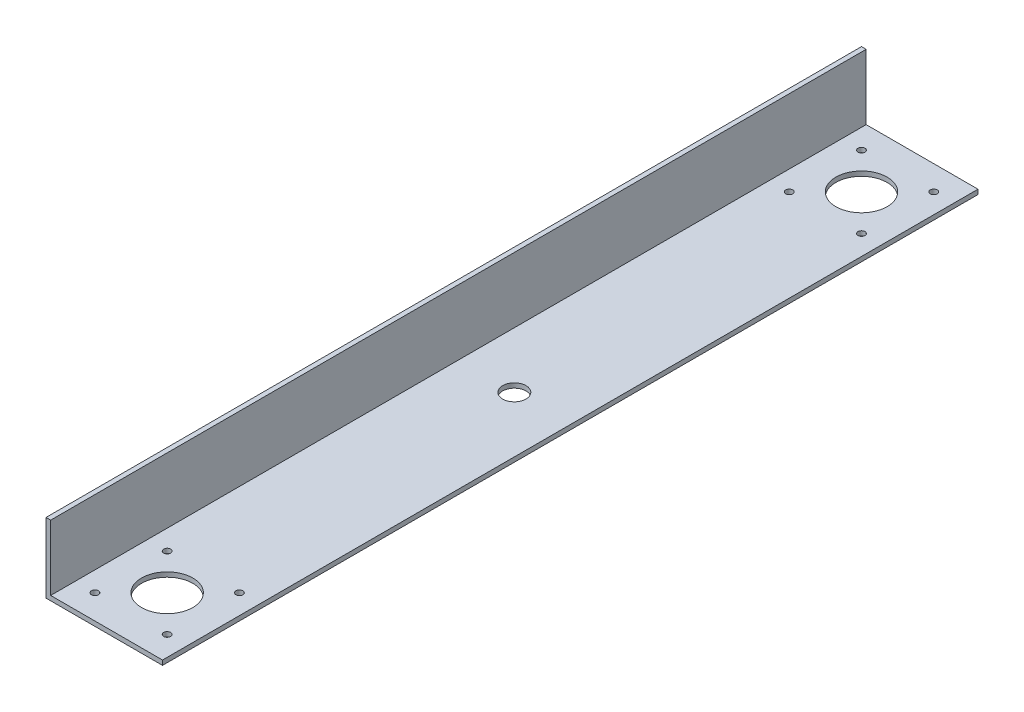
from build123d import *

# Parameters (mm, degrees)
BOSS_EXTRUDE1_DEPTH = 350
SKETCH6_R           = 1.5
CUT_EXTRUDE3_DEPTH  = 355.660400947
SKETCH7_R           = 11
CUT_EXTRUDE4_DEPTH  = 355.660400947
SKETCH8_R           = 11
CUT_EXTRUDE5_DEPTH  = 355.823899984
SKETCH9_R           = 1.5
CUT_EXTRUDE6_DEPTH  = 355.823899984
SKETCH10_R          = 5
CUT_EXTRUDE7_DEPTH  = 355.823899984


with BuildPart() as part:
    # Sketch1 → Boss-Extrude1 (new body)
    with BuildSketch(Plane.XY):
        Polygon((0, 0), (0, 30), (2, 30), (2, 2), (50, 2), (50, 0), align=None)
    extrude(amount=BOSS_EXTRUDE1_DEPTH)

    # Sketch6 → Cut-Extrude3 (cut, through all)
    with BuildSketch(Plane(origin=(0, 2, 0), x_dir=(1, 0, 0), z_dir=(0, 1, 0))):
        with Locations(Location((41.5, -339.5, 0), (0, 0, 270))):
            Circle(SKETCH6_R)
        with Locations(Location((10.5, -308.5, 0), (0, 0, 270))):
            Circle(SKETCH6_R)
        with Locations(Location((10.5, -339.5, 0), (0, 0, 270))):
            Circle(SKETCH6_R)
        with Locations(Location((41.5, -308.5, 0), (0, 0, 270))):
            Circle(SKETCH6_R)
    extrude(amount=-CUT_EXTRUDE3_DEPTH, mode=Mode.SUBTRACT)

    # Sketch7 → Cut-Extrude4 (cut, through all)
    with BuildSketch(Plane(origin=(0, 2, 0), x_dir=(1, 0, 0), z_dir=(0, 1, 0))):
        with Locations(Location((26, -324, 0), (0, 0, 270))):
            Circle(SKETCH7_R)
    extrude(amount=-CUT_EXTRUDE4_DEPTH, mode=Mode.SUBTRACT)

    # Sketch8 → Cut-Extrude5 (cut, through all)
    with BuildSketch(Plane(origin=(0, 0, 0), x_dir=(-1, 0, 0), z_dir=(0, -1, 0))):
        with Locations(Location((-26, -26, 0), (0, 0, 180))):
            Circle(SKETCH8_R)
    extrude(amount=-CUT_EXTRUDE5_DEPTH, mode=Mode.SUBTRACT)

    # Sketch9 → Cut-Extrude6 (cut, through all)
    with BuildSketch(Plane.XZ):
        with Locations((41.5, 41.5)):
            Circle(SKETCH9_R)
        with Locations((10.5, 41.5)):
            Circle(SKETCH9_R)
        with Locations((10.5, 10.5)):
            Circle(SKETCH9_R)
        with Locations((41.5, 10.5)):
            Circle(SKETCH9_R)
    extrude(amount=-CUT_EXTRUDE6_DEPTH, mode=Mode.SUBTRACT)

    # Sketch10 → Cut-Extrude7 (cut, through all)
    with BuildSketch(Plane.XZ):
        with Locations((26.000000572, 175)):
            Circle(SKETCH10_R)
    extrude(amount=-CUT_EXTRUDE7_DEPTH, mode=Mode.SUBTRACT)


solid = part.part
